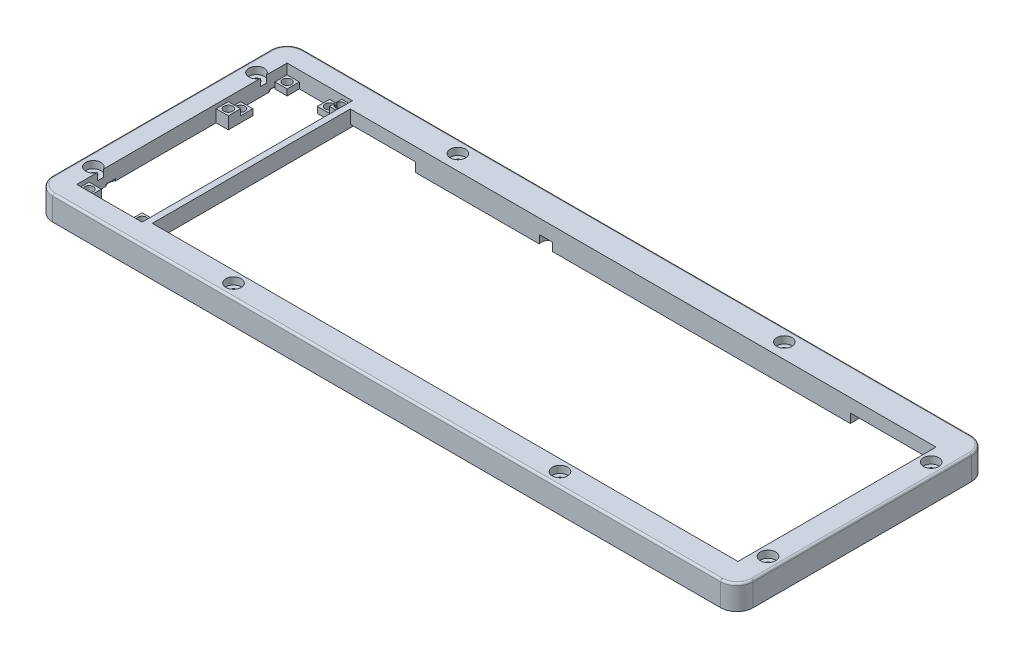
from build123d import *

# Parameters (mm, degrees)
SKETCH_1_W              = 337.35
SKETCH_1_H              = 116.87
SKETCH_1_W_2            = 324.05
SKETCH_1_H_2            = 103.07
EXTRUDE_1_DEPTH         = 8
FILLET_1_R              = 5
HOLE_WIZARD_3_2_3_2_1_D = 3.2
SKETCH_5_W              = 32
SKETCH_5_H              = 1.5
CUT_EXTRUDE_1_DEPTH     = 355.911853
EXTRUDE_2_REACH         = 356.912
SKETCH_6_W              = 3
SKETCH_6_H              = 8
SKETCH_7_W              = 257.05
SKETCH_7_H              = 8
EXTRUDE_3_DEPTH         = 4
SKETCH_8_W              = 257.05
SKETCH_8_H              = 4
EXTRUDE_4_DEPTH         = 3
SKETCH_11_W             = 99.07
SKETCH_11_H             = 11
EXTRUDE_5_DEPTH         = 2
SKETCH_13_W             = 42
SKETCH_13_H             = 4.5
CUT_EXTRUDE_2_DEPTH     = 354.692894189
SKETCH_14_W             = 121.5
SKETCH_14_H             = 1.5
CUT_EXTRUDE_3_DEPTH     = 355.911853
SKETCH_16_W             = 32
SKETCH_16_H             = 6.5
EXTRUDE_7_DEPTH         = 4
SKETCH_17_W             = 103.07
SKETCH_17_H             = 3
CUT_EXTRUDE_4_DEPTH     = 0.1
EXTRUDE_8_DEPTH         = 2
SKETCH_19_W             = 70.55
SKETCH_19_H             = 2
SKETCH_19_W_2           = 95
EXTRUDE_9_DEPTH         = 3
SKETCH_20_R             = 3.5
CUT_EXTRUDE_5_DEPTH     = 4
EXTRUDE_10_DEPTH        = 12
SKETCH_22_W             = 44.9064152
SKETCH_22_H             = 4
CUT_EXTRUDE_6_DEPTH     = 9.9
SKETCH_23_W             = 6
SKETCH_23_H             = 6
SKETCH_23_R             = 2.15
EXTRUDE_11_DEPTH        = 3
SKETCH_26_W             = 5.2
SKETCH_26_H             = 6
SKETCH_26_W_2           = 6
EXTRUDE_12_DEPTH        = 6
SKETCH_27_W             = 6
SKETCH_27_H             = 6
EXTRUDE_13_DEPTH        = 3
SKETCH_28_R             = 2.15
CUT_EXTRUDE_7_DEPTH     = 4.2
CUT_EXTRUDE_8_REACH     = 362.981
SKETCH_29_W             = 0.1
SKETCH_29_H             = 0.921954446
SKETCH_30_R             = 3.75
CUT_EXTRUDE_9_DEPTH     = 3.5
FILLET_3_R              = 1


with BuildPart() as part:
    # 草图1 → 凸台-拉伸1 (new body)
    with BuildSketch(Plane(origin=(0, 0, 0), x_dir=(1, 0, 0), z_dir=(0, 1, 0))):
        with Locations((168.675, 58.435)):
            Rectangle(SKETCH_1_W, SKETCH_1_H)
        with Locations((168.925, 58.435)):
            Rectangle(SKETCH_1_W_2, SKETCH_1_H_2, mode=Mode.SUBTRACT)
    extrude(amount=EXTRUDE_1_DEPTH)

    # 圆角1
    fillet_1_edges = [part.edges().sort_by_distance(p)[0] for p in [
        (0, 4, -116.87),
        (337.35, 4, -116.87),
        (337.35, 4, 0),
        (0, 4, 0),
    ]]
    fillet(fillet_1_edges, radius=FILLET_1_R)

    # Ø3.2 (3.2) 直径孔1 (through all)
    with Locations(Plane(origin=(0, 8, 0), x_dir=(1, 0, 0), z_dir=(0, 1, 0))):
        with Locations((3.45, 98.435), (87.17, 113.42), (247.17, 113.42), (334.15, 98.435), (334.15, 18.435), (247.17, 3.45), (87.17, 3.45), (3.45, 18.435)):
            Hole(HOLE_WIZARD_3_2_3_2_1_D / 2)

    # 草图5 → 切除-拉伸1 (cut, through all)
    with BuildSketch(Plane.XY.offset(-109.97)):
        with Locations((57.9, 0.75)):
            Rectangle(SKETCH_5_W, SKETCH_5_H)
    extrude(amount=-CUT_EXTRUDE_1_DEPTH, mode=Mode.SUBTRACT)

    # 草图6 → 凸台-拉伸2 (add, up to next)
    with BuildSketch(Plane.XY.offset(-109.97), mode=Mode.PRIVATE) as extrude_2_sk1:
        with Locations((40.4, 4)):
            Rectangle(SKETCH_6_W, SKETCH_6_H)
    extrude_2_tool1 = extrude(extrude_2_sk1.sketch, amount=EXTRUDE_2_REACH, mode=Mode.PRIVATE) - part.part
    add(extrude_2_tool1.solids().sort_by_distance((40.4, 4, -109.97))[0])

    # 草图7 → 凸台-拉伸3 (add)
    with BuildSketch(Plane.XY.offset(-109.97)):
        with Locations((202.425, 4)):
            Rectangle(SKETCH_7_W, SKETCH_7_H)
    extrude(amount=EXTRUDE_3_DEPTH)

    # 草图8 → 凸台-拉伸4 (add)
    with BuildSketch(Plane.XZ):
        with Locations((202.425, -107.97)):
            Rectangle(SKETCH_8_W, SKETCH_8_H)
    extrude(amount=EXTRUDE_4_DEPTH)

    # 草图11 → 凸台-拉伸5 (add)
    with BuildSketch(Plane.ZY.offset(-330.95)):
        with Locations((-56.435, 2.5)):
            Rectangle(SKETCH_11_W, SKETCH_11_H)
    extrude(amount=EXTRUDE_5_DEPTH)

    # 草图13 → 切除-拉伸2 (cut, through all)
    with BuildSketch(Plane.XY.offset(-105.97)):
        with Locations((307.95, -0.75)):
            Rectangle(SKETCH_13_W, SKETCH_13_H)
    extrude(amount=-CUT_EXTRUDE_2_DEPTH, mode=Mode.SUBTRACT)

    # 草图14 → 切除-拉伸3 (cut, through all)
    with BuildSketch(Plane(origin=(0, 0, -6.9), x_dir=(-1, 0, 0), z_dir=(0, 0, -1))):
        with Locations((-173.2, 0.75)):
            Rectangle(SKETCH_14_W, SKETCH_14_H)
    extrude(amount=-CUT_EXTRUDE_3_DEPTH, mode=Mode.SUBTRACT)

    # 草图16 → 凸台-拉伸7 (add)
    with BuildSketch(Plane.XY.offset(-109.97)):
        with Locations((57.9, 4.75)):
            Rectangle(SKETCH_16_W, SKETCH_16_H)
    extrude(amount=EXTRUDE_7_DEPTH)

    # 草图17 → 切除-拉伸4 (cut)
    with BuildSketch(Plane(origin=(330.95, 0, 0), x_dir=(0, 0, -1), z_dir=(1, 0, 0))):
        with Locations((58.435, -1.5)):
            Rectangle(SKETCH_17_W, SKETCH_17_H)
    extrude(amount=-CUT_EXTRUDE_4_DEPTH, mode=Mode.SUBTRACT)

    # 草图18 → 凸台-拉伸8 (add)
    with BuildSketch(Plane(origin=(0, 0, -6.9), x_dir=(-1, 0, 0), z_dir=(0, 0, -1))):
        Polygon((-233.95, 0), (-233.95, 1.5), (-112.45, 1.5), (-112.45, 0), (-41.9, 0), (-41.9, 8), (-328.95, 8), (-328.95, 0), align=None)
    extrude(amount=EXTRUDE_8_DEPTH)

    # 草图19 → 凸台-拉伸9 (add)
    with BuildSketch(Plane.XZ):
        with Locations((77.175, -7.9)):
            Rectangle(SKETCH_19_W, SKETCH_19_H)
        with Locations((281.45, -7.9)):
            Rectangle(SKETCH_19_W_2, SKETCH_19_H)
    extrude(amount=EXTRUDE_9_DEPTH)

    # 草图20 → 切除-拉伸5 (cut)
    with BuildSketch(Plane.XZ.offset(3)):
        with Locations((92.088456012, -9.54)):
            Circle(SKETCH_20_R)
        with Locations((262.268456012, -9.54)):
            Circle(SKETCH_20_R)
        with Locations((328.308456012, -13.35)):
            Circle(SKETCH_20_R)
        with Locations((328.308456012, -74.31)):
            Circle(SKETCH_20_R)
        with Locations((137.808456012, -107.33)):
            Circle(SKETCH_20_R)
        with Locations((22.238456012, -9.54)):
            Circle(SKETCH_20_R)
        with Locations((9.538456012, -23.51)):
            Circle(SKETCH_20_R)
        with Locations((9.538456012, -103.52)):
            Circle(SKETCH_20_R)
    extrude(amount=-CUT_EXTRUDE_5_DEPTH, mode=Mode.SUBTRACT)

    # 草图21 → 凸台-拉伸10 (add)
    with BuildSketch(Plane(origin=(0, 8, 0), x_dir=(1, 0, 0), z_dir=(0, 1, 0))):
        with BuildLine():
            Line((-3, 111.87), (-3, 5))
            ThreePointArc((-3, 5), (-0.656854249, -0.656854249), (5, -3))
            Line((5, -3), (332.35, -3))
            ThreePointArc((332.35, -3), (338.006854249, -0.656854249), (340.35, 5))
            Line((340.35, 5), (340.35, 111.87))
            ThreePointArc((340.35, 111.87), (338.006854249, 117.526854249), (332.35, 119.87))
            Line((332.35, 119.87), (5, 119.87))
            ThreePointArc((5, 119.87), (-0.656854249, 117.526854249), (-3, 111.87))
        make_face()
        with BuildLine():
            Line((0, 111.87), (0, 5))
            ThreePointArc((0, 5), (1.464466094, 1.464466094), (5, 0))
            Line((5, 0), (332.35, 0))
            ThreePointArc((332.35, 0), (335.885533906, 1.464466094), (337.35, 5))
            Line((337.35, 5), (337.35, 111.87))
            ThreePointArc((337.35, 111.87), (335.885533906, 115.405533906), (332.35, 116.87))
            Line((332.35, 116.87), (5, 116.87))
            ThreePointArc((5, 116.87), (1.464466094, 115.405533906), (0, 111.87))
        make_face(mode=Mode.SUBTRACT)
    extrude(amount=-EXTRUDE_10_DEPTH)

    # 草图22 → 切除-拉伸6 (cut)
    with BuildSketch(Plane(origin=(0, 0, -119.87), x_dir=(-1, 0, 0), z_dir=(0, 0, -1))):
        with Locations((-33.455248412, -2)):
            Rectangle(SKETCH_22_W, SKETCH_22_H)
    extrude(amount=-CUT_EXTRUDE_6_DEPTH, mode=Mode.SUBTRACT)

    # 草图23 → 凸台-拉伸11 (add)
    # profile 1 of 5: a face of its own
    with BuildSketch(Plane.XZ):
        with Locations((9.9, -9.9)):
            Rectangle(SKETCH_23_W, SKETCH_23_H)
    # profile 2 of 5: a face of its own
    with BuildSketch(Plane.XZ):
        with Locations((35.9, -9.9)):
            Rectangle(SKETCH_23_W, SKETCH_23_H)
    # profile 3 of 5: a face of its own
    with BuildSketch(Plane.XZ):
        with Locations((9.9, -106.97)):
            Rectangle(SKETCH_23_W, SKETCH_23_H)
        with Locations(Location((9.9, -106.97, 0), (0, 0, 270))):
            Circle(SKETCH_23_R, mode=Mode.SUBTRACT)
    # profile 4 of 5: a face of its own
    with BuildSketch(Plane.XZ):
        with Locations((9.9, -84.17)):
            Rectangle(SKETCH_23_W, SKETCH_23_H)
        with Locations(Location((9.9, -84.17, 0), (0, 0, 270))):
            Circle(SKETCH_23_R, mode=Mode.SUBTRACT)
    # profile 5 of 5: a face of its own
    with BuildSketch(Plane.XZ):
        with Locations((30.7, -106.97)):
            Rectangle(SKETCH_23_W, SKETCH_23_H)
        with Locations(Location((30.7, -106.97, 0), (0, 0, 270))):
            Circle(SKETCH_23_R, mode=Mode.SUBTRACT)
    extrude(amount=-EXTRUDE_11_DEPTH)

    # 草图26 → 凸台-拉伸12 (add)
    with BuildSketch(Plane.XZ):
        with Locations((36.3, -106.97)):
            Rectangle(SKETCH_26_W, SKETCH_26_H)
        with Locations((9.9, -78.17)):
            Rectangle(SKETCH_26_W_2, SKETCH_26_H)
    extrude(amount=-EXTRUDE_12_DEPTH)

    # 草图27 → 凸台-拉伸13 (add)
    with BuildSketch(Plane(origin=(0, 3, 0), x_dir=(1, 0, 0), z_dir=(0, 1, 0))):
        with Locations((9.9, 9.9)):
            Rectangle(SKETCH_27_W, SKETCH_27_H)
        with Locations((35.9, 9.9)):
            Rectangle(SKETCH_27_W, SKETCH_27_H)
    extrude(amount=EXTRUDE_13_DEPTH)

    # 草图28 → 切除-拉伸7 (cut)
    with BuildSketch(Plane(origin=(0, 6, 0), x_dir=(1, 0, 0), z_dir=(0, 1, 0))):
        with Locations(Location((35.9, 106.97, 0), (0, 0, 270))):
            Circle(SKETCH_28_R)
        with Locations(Location((35.9, 9.9, 0), (0, 0, 270))):
            Circle(SKETCH_28_R)
        with Locations(Location((9.9, 9.9, 0), (0, 0, 270))):
            Circle(SKETCH_28_R)
        with Locations(Location((9.9, 78.17, 0), (0, 0, 270))):
            Circle(SKETCH_28_R)
    extrude(amount=-CUT_EXTRUDE_7_DEPTH, mode=Mode.SUBTRACT)

    # 切除-拉伸8: up to this face of the body (flat: up to its plane)
    cut_extrude_8_end = Plane(part.part.faces().sort_by_distance((35.9, 1.8, -106.97))[0])
    # 草图29 → 切除-拉伸8 (cut, up to the picked face)
    with BuildSketch(Plane(origin=(0, 6, 0), x_dir=(1, 0, 0), z_dir=(0, 1, 0)), mode=Mode.PRIVATE) as cut_extrude_8_sk1:
        with Locations((33.75, 106.97)):
            Rectangle(SKETCH_29_W, SKETCH_29_H)
    cut_extrude_8_tool1 = split(extrude(cut_extrude_8_sk1.sketch, amount=-CUT_EXTRUDE_8_REACH, mode=Mode.PRIVATE), bisect_by=cut_extrude_8_end, keep=Keep.BOTH, mode=Mode.PRIVATE)
    add(cut_extrude_8_tool1.solids().sort_by(Axis((33.75, 6, -106.97), (0, -1, 0)))[0], mode=Mode.SUBTRACT)

    # 草图30 → 切除-拉伸9 (cut)
    with BuildSketch(Plane(origin=(0, 8, 0), x_dir=(1, 0, 0), z_dir=(0, 1, 0))):
        with Locations(Location((87.17, 113.42, 0), (0, 0, 270))):
            Circle(SKETCH_30_R)
        with Locations(Location((247.17, 113.42, 0), (0, 0, 270))):
            Circle(SKETCH_30_R)
        with Locations(Location((334.15, 98.435, 0), (0, 0, 270))):
            Circle(SKETCH_30_R)
        with Locations(Location((334.15, 18.435, 0), (0, 0, 270))):
            Circle(SKETCH_30_R)
        with Locations(Location((87.17, 3.45, 0), (0, 0, 270))):
            Circle(SKETCH_30_R)
        with Locations(Location((247.17, 3.45, 0), (0, 0, 270))):
            Circle(SKETCH_30_R)
        with Locations((3.45, 18.435)):
            Circle(SKETCH_30_R)
        with Locations((3.45, 98.435)):
            Circle(SKETCH_30_R)
    extrude(amount=-CUT_EXTRUDE_9_DEPTH, mode=Mode.SUBTRACT)

    # 圆角3
    fillet_3_edges = [part.edges().sort_by_distance(p)[0] for p in [
        (-0.656854249, 8, -117.526854249),
        (-3, 8, -58.435),
        (-0.656854249, 8, 0.656854249),
        (168.675, 8, 3),
        (338.006854249, 8, 0.656854249),
        (340.35, 8, -58.435),
        (338.006854249, 8, -117.526854249),
        (168.675, 8, -119.87),
    ]]
    fillet(fillet_3_edges, radius=FILLET_3_R)


solid = part.part
